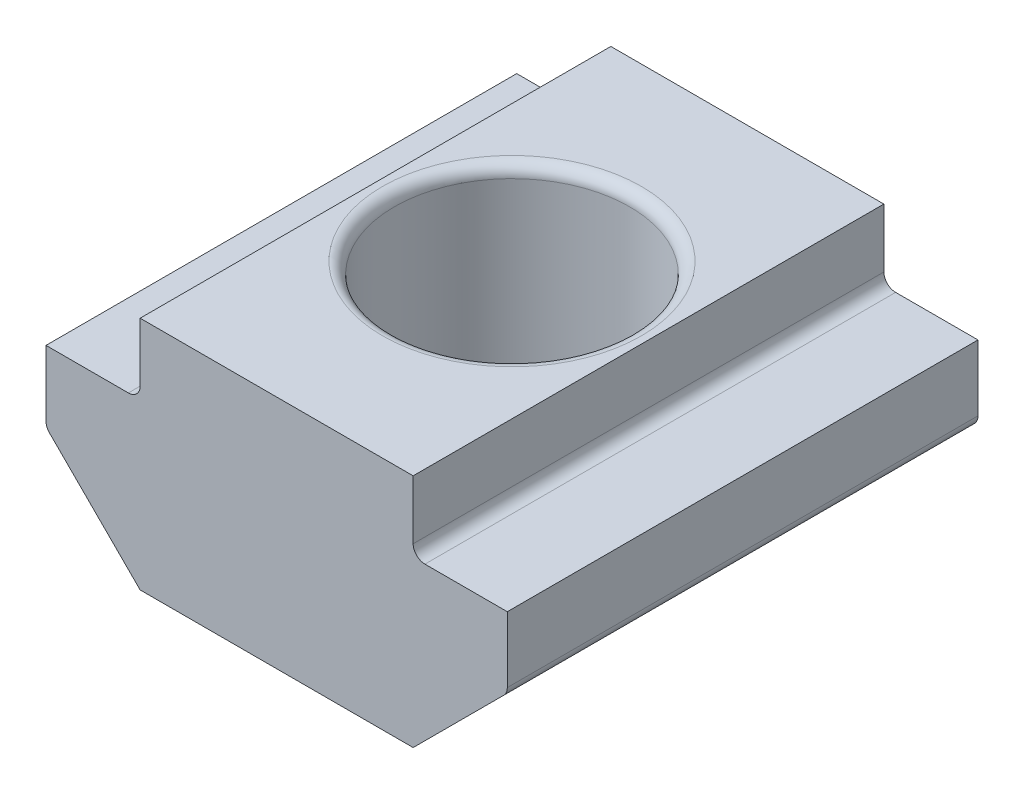
from build123d import *

# Parameters (mm, degrees)
BOSS_EXTRUDE1_DEPTH     = 5
CUT_EXTRUDE1_DEPTH      = 9.189780217
CUT_EXTRUDE1_DEPTH_BACK = 9.189780217
SKETCH2_R               = 2.5
FILLET1_R               = 0.25
FILLET2_R               = 0.25


with BuildPart() as part:
    # Sketch1 → Boss-Extrude1 (new, symmetric)
    with BuildSketch(Plane.XY):
        Polygon((-2.9, -0.75), (-2.9, 0.75), (2.9, 0.75), (2.9, -0.75), (4.9, -0.75), (4.9, -2.25), (2.9, -4.25), (-2.9, -4.25), (-4.9, -2.25), (-4.9, -0.75), align=None)
    extrude(amount=BOSS_EXTRUDE1_DEPTH, both=True)

    # Sketch2 → Cut-Extrude1 (cut, two sides: drawn at the far end of the back side and taken through both)
    with BuildSketch(Plane(origin=(0, 0, 0), x_dir=(1, 0, 0), z_dir=(0, 1, 0)).offset(-CUT_EXTRUDE1_DEPTH_BACK)):
        with Locations(Location((0, 0, 0), (0, 0, 270))):
            Circle(SKETCH2_R)
    extrude(amount=CUT_EXTRUDE1_DEPTH + CUT_EXTRUDE1_DEPTH_BACK, mode=Mode.SUBTRACT)

    # Fillet1
    fillet1_edges = [part.edges().sort_by_distance(p)[0] for p in [
        (2.9, -0.75, 0),
        (4.9, -2.25, 0),
        (-4.9, -2.25, 0),
        (-2.9, -0.75, 0),
    ]]
    fillet(fillet1_edges, radius=FILLET1_R)

    # Fillet2
    fillet2_edges = [part.edges().sort_by_distance(p)[0] for p in [
        (0, -4.25, -2.5),
        (0, 0.75, -2.5),
    ]]
    fillet(fillet2_edges, radius=FILLET2_R)


solid = part.part
